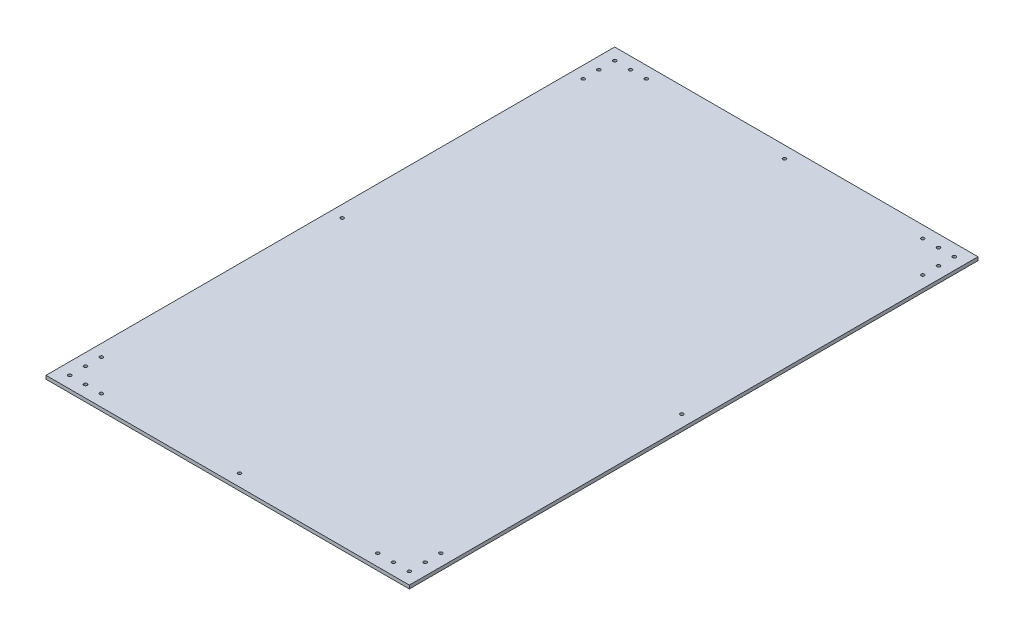
from build123d import *

# Parameters (mm, degrees)
SKETCH1_W                  = 609.6
SKETCH1_H                  = 1219.2
BOSS_EXTRUDE1_DEPTH        = 5.5
SKETCH2_W                  = 584.2
SKETCH2_H                  = 2.54
EXTRUDE_THIN1_DEPTH        = 25.4
SKETCH2_3_W                = 2.54
SKETCH2_3_H                = 1219.2
SKETCH2_3_W_2              = 584.2
SKETCH2_3_H_2              = 2.54
EXTRUDE_THIN2_DEPTH        = 25.4
F_5_3_5_3_DIAMETER_HOLE1_D = 5.3
CUT_EXTRUDE1_REACH         = 684.254


with BuildPart() as part:
    # Sketch1 → Boss-Extrude1 (new body)
    with BuildSketch(Plane(origin=(0, 0, 0), x_dir=(1, 0, 0), z_dir=(0, 1, 0))):
        Rectangle(SKETCH1_W, SKETCH1_H)
    extrude(amount=BOSS_EXTRUDE1_DEPTH)

    # Sketch2 → Extrude-Thin1 (add)
    with BuildSketch(Plane(origin=(0, 5.5, 0), x_dir=(1, 0, 0), z_dir=(0, 1, 0))):
        with Locations((12.7, 306.07)):
            Rectangle(SKETCH2_W, SKETCH2_H)
    extrude(amount=EXTRUDE_THIN1_DEPTH)

    # Sketch2<3> → Extrude-Thin2 (add)
    with BuildSketch(Plane(origin=(0, 5.5, 0), x_dir=(1, 0, 0), z_dir=(0, 1, 0))):
        with Locations((-280.67, 0)):
            Rectangle(SKETCH2_3_W, SKETCH2_3_H)
        with Locations((12.7, 306.07)):
            Rectangle(SKETCH2_3_W_2, SKETCH2_3_H_2)
    extrude(amount=EXTRUDE_THIN2_DEPTH)

    # Ø5.3 (5.3) Diameter Hole1 (through all)
    with Locations(Plane(origin=(0, 5.5, 0), x_dir=(1, 0, 0), z_dir=(0, 1, 0))):
        with Locations((-260.35, 285.75), (-234.95, 285.75), (-209.55, 285.75), (-260.35, 260.35), (-260.35, 234.95), (12.7, 285.75), (234.95, 285.75), (260.35, 285.75), (285.75, 285.75), (285.75, 260.35), (285.75, 234.95), (-260.35, -152.4), (285.75, -152.4), (-260.35, -539.75), (-260.35, -565.15), (-260.35, -590.55), (-234.95, -590.55), (-209.55, -590.55), (12.7, -590.55), (234.95, -590.55), (260.35, -590.55), (285.75, -590.55), (285.75, -565.15), (285.75, -539.75)):
            Hole(F_5_3_5_3_DIAMETER_HOLE1_D / 2)

    # Sketch6 → Cut-Extrude1 (cut, up to next)
    with BuildSketch(Plane.XZ, mode=Mode.PRIVATE) as cut_extrude1_sk1:
        Polygon((-304.8, 609.6), (-279.4, 609.6), (-279.4, -304.8), (304.8, -304.8), (304.8, -609.6), (-279.4, -609.6), (-304.8, -609.6), align=None)
    cut_extrude1_tool1 = extrude(cut_extrude1_sk1.sketch, amount=-CUT_EXTRUDE1_REACH, mode=Mode.PRIVATE) & part.part
    add(cut_extrude1_tool1.solids().sort_by_distance((-32.455556, 0, -389.466667))[0], mode=Mode.SUBTRACT)


solid = part.part
